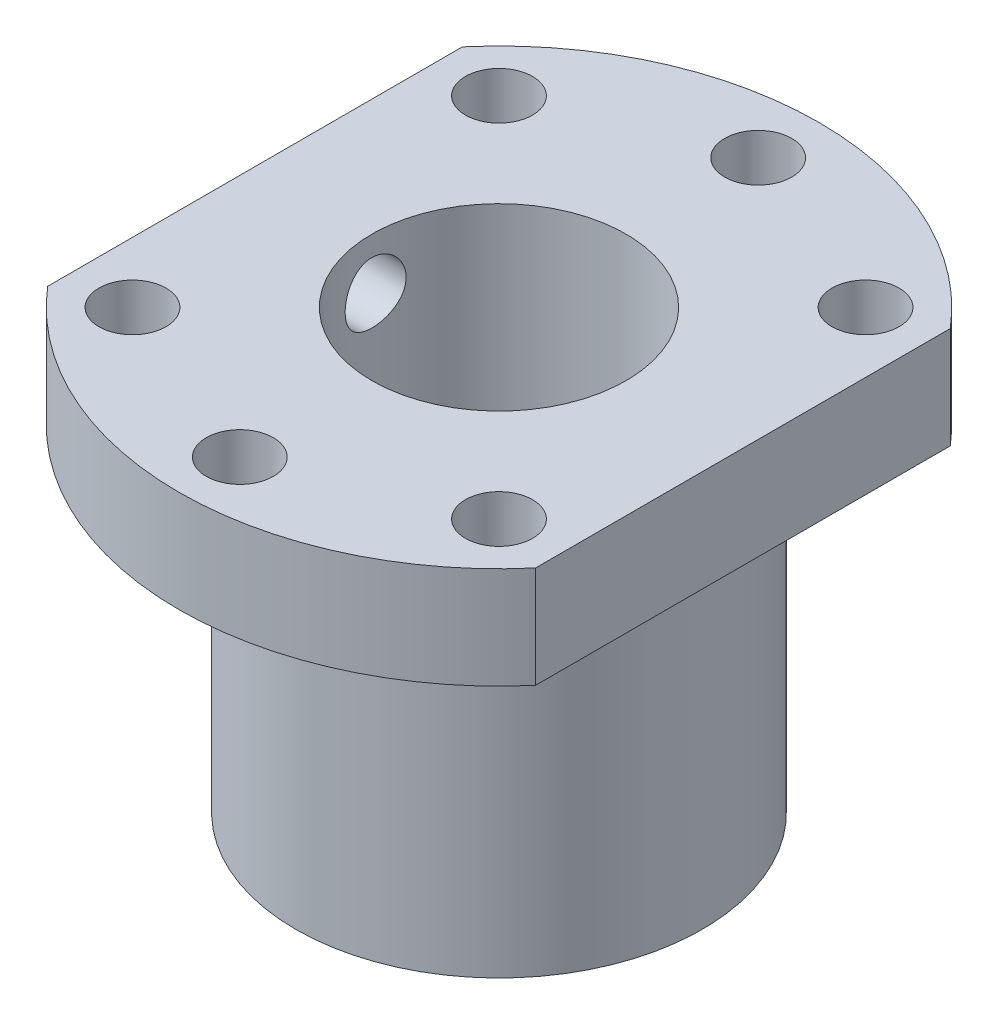
from build123d import *

# Parameters (mm, degrees)
SKETCH_1_R          = 12.5
EXTRUDE_1_DEPTH     = 10
SKETCH_2_R          = 20
SKETCH_2_R_2        = 12.5
EXTRUDE_2_DEPTH     = 43
SKETCH_3_R          = 3.3
CUT_EXTRUDE_1_DEPTH = 59.457249337
SKETCH_4_R          = 3
CUT_EXTRUDE_2_DEPTH = 59.457249337


with BuildPart() as part:
    # 草图1 → 凸台-拉伸1 (new body)
    with BuildSketch(Plane(origin=(0, 0, 0), x_dir=(1, 0, 0), z_dir=(0, 1, 0))):
        with BuildLine():
            Line((-24, 20.402205763), (-24, -20.402205763))
            ThreePointArc((-24, -20.402205763), (0, -31.5), (24, -20.402205763))
            Line((24, -20.402205763), (24, 20.402205763))
            ThreePointArc((24, 20.402205763), (0, 31.5), (-24, 20.402205763))
        make_face()
        with Locations(Location((0, 0, 0), (0, 0, 270))):
            Circle(SKETCH_1_R, mode=Mode.SUBTRACT)
    extrude(amount=-EXTRUDE_1_DEPTH)

    # 草图2 → 凸台-拉伸2 (add)
    with BuildSketch(Plane(origin=(0, 0, 0), x_dir=(1, 0, 0), z_dir=(0, 1, 0))):
        with Locations(Location((0, 0, 0), (0, 0, 270))):
            Circle(SKETCH_2_R)
        with Locations(Location((0, 0, 0), (0, 0, 270))):
            Circle(SKETCH_2_R_2, mode=Mode.SUBTRACT)
    extrude(amount=-EXTRUDE_2_DEPTH)

    # 草图3 → 切除-拉伸1 (cut, through all)
    with BuildSketch(Plane(origin=(0, 0, 0), x_dir=(1, 0, 0), z_dir=(0, 1, 0))):
        with Locations(Location((0, 25.5, 0), (0, 0, 270))):
            Circle(SKETCH_3_R)
        with Locations(Location((-18.03122292, 18.03122292, 0), (0, 0, 270))):
            Circle(SKETCH_3_R)
        with Locations(Location((18.03122292, 18.03122292, 0), (0, 0, 270))):
            Circle(SKETCH_3_R)
        with Locations(Location((18.03122292, -18.03122292, 0), (0, 0, 270))):
            Circle(SKETCH_3_R)
        with Locations(Location((-18.03122292, -18.03122292, 0), (0, 0, 270))):
            Circle(SKETCH_3_R)
        with Locations(Location((0, -25.5, 0), (0, 0, 270))):
            Circle(SKETCH_3_R)
    extrude(amount=-CUT_EXTRUDE_1_DEPTH, mode=Mode.SUBTRACT)

    # 草图4 → 切除-拉伸2 (cut, through all)
    with BuildSketch(Plane(origin=(0, 0, 0), x_dir=(0, 0, -1), z_dir=(1, 0, 0))):
        with Locations((0, -5)):
            Circle(SKETCH_4_R)
    extrude(amount=-CUT_EXTRUDE_2_DEPTH, mode=Mode.SUBTRACT)


solid = part.part
